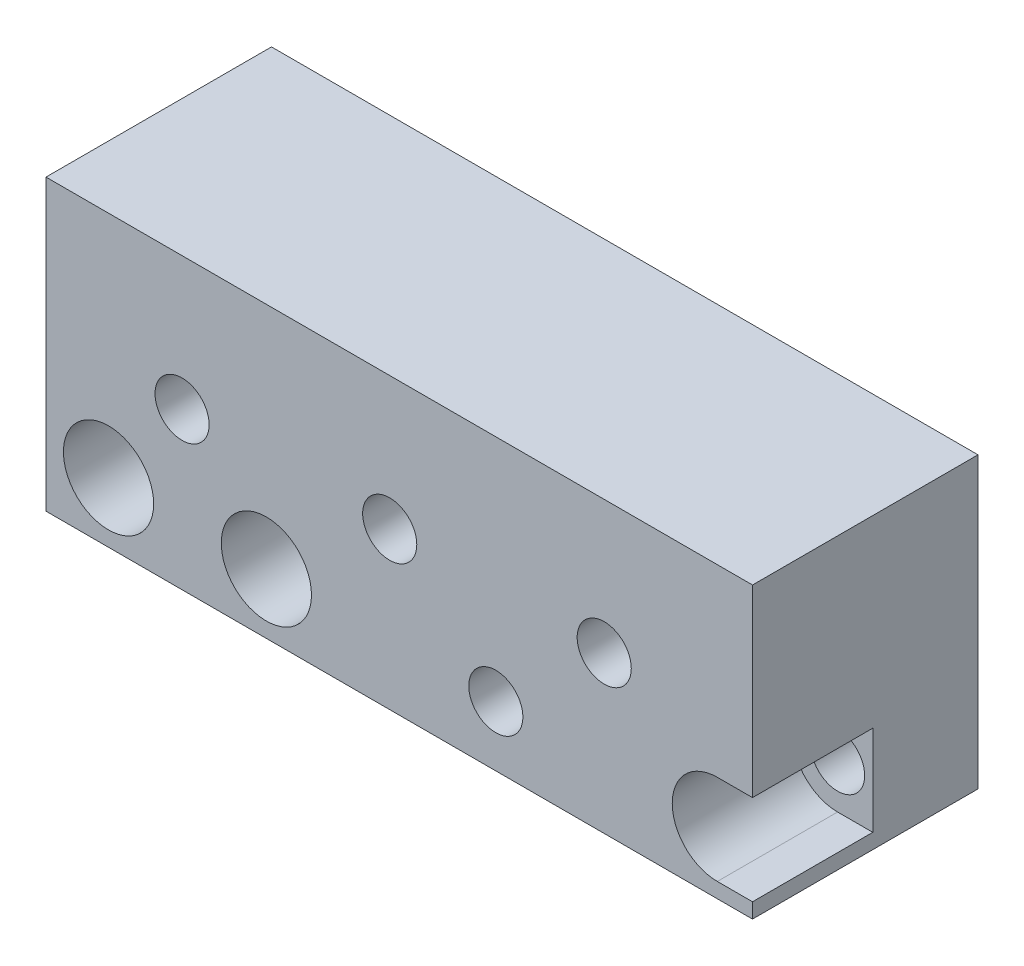
from build123d import *

# Parameters (mm, degrees)
SKETCH_1_W          = 47
SKETCH_1_H          = 20
EXTRUDE_1_DEPTH     = 15
SKETCH_2_R          = 1.8
CUT_EXTRUDE_1_DEPTH = 34.183673518
SKETCH_3_R          = 3
CUT_EXTRUDE_2_DEPTH = 8
SKETCH_4_R          = 1.8
CUT_EXTRUDE_3_DEPTH = 28
CUT_EXTRUDE_4_DEPTH = 8
SKETCH_6_W          = 47
SKETCH_6_H          = 0.75
CUT_EXTRUDE_5_DEPTH = 34.183673518
SKETCH_8_W          = 7.045850492
SKETCH_8_H          = 8.215580819
EXTRUDE_2_DEPTH     = 15
SKETCH_7_R          = 1.8
CUT_EXTRUDE_6_DEPTH = 34.183673518
SKETCH_9_R          = 3
CUT_EXTRUDE_7_DEPTH = 8
SKETCH_10_W         = 2.34075738
SKETCH_10_H         = 6
CUT_EXTRUDE_8_DEPTH = 8


with BuildPart() as part:
    # 草图1 → 凸台-拉伸1 (new body)
    with BuildSketch(Plane.XY):
        with Locations((2.432038835, 4.27184466)):
            Rectangle(SKETCH_1_W, SKETCH_1_H)
    extrude(amount=EXTRUDE_1_DEPTH)

    # 草图2 → 切除-拉伸1 (cut, through all)
    with BuildSketch(Plane.XY.offset(15)):
        with Locations((-16.908718548, -0.97815534)):
            Circle(SKETCH_2_R)
        with Locations((-6.408718548, -0.97815534)):
            Circle(SKETCH_2_R)
        with Locations((22.591281452, -0.97815534)):
            Circle(SKETCH_2_R)
    extrude(amount=-CUT_EXTRUDE_1_DEPTH, mode=Mode.SUBTRACT)

    # 草图3 → 切除-拉伸2 (cut)
    with BuildSketch(Plane.XY.offset(15)):
        with Locations((-16.908718548, -0.97815534)):
            Circle(SKETCH_3_R)
        with Locations((-6.408718548, -0.97815534)):
            Circle(SKETCH_3_R)
        with Locations((22.591281452, -0.97815534)):
            Circle(SKETCH_3_R)
    extrude(amount=-CUT_EXTRUDE_2_DEPTH, mode=Mode.SUBTRACT)

    # 草图4 → 切除-拉伸3 (cut)
    with BuildSketch(Plane.XY.offset(15)):
        with Locations((8.856176416, -0.97815534)):
            Circle(SKETCH_4_R)
        with Locations((-12.015922761, 5.426389834)):
            Circle(SKETCH_4_R)
        with Locations((1.797242631, 5.426389834)):
            Circle(SKETCH_4_R)
        with Locations((16.06746129, 5.426389834)):
            Circle(SKETCH_4_R)
    extrude(amount=-CUT_EXTRUDE_3_DEPTH, mode=Mode.SUBTRACT)

    # 草图5 → 切除-拉伸4 (cut)
    with BuildSketch(Plane(origin=(0, 0, 0), x_dir=(-1, 0, 0), z_dir=(0, 0, -1))):
        Polygon((-11.656176416, 0.638425414), (-11.656176416, -2.594736094), (-8.856176416, -4.211316847), (-6.056176416, -2.594736094), (-6.056176416, 0.638425414), (-8.856176416, 2.255006168), align=None)
        Polygon((-17.684042044, 2.626389834), (-14.450880536, 2.626389834), (-12.834299783, 5.426389834), (-14.450880536, 8.226389834), (-17.684042044, 8.226389834), (-19.300622797, 5.426389834), align=None)
        Polygon((-3.413823385, 2.626389834), (-0.180661878, 2.626389834), (1.435918876, 5.426389834), (-0.180661878, 8.226389834), (-3.413823385, 8.226389834), (-5.030404139, 5.426389834), align=None)
        Polygon((10.399342007, 2.626389834), (13.632503515, 2.626389834), (15.249084268, 5.426389834), (13.632503515, 8.226389834), (10.399342007, 8.226389834), (8.782761253, 5.426389834), align=None)
    extrude(amount=-CUT_EXTRUDE_4_DEPTH, mode=Mode.SUBTRACT)

    # 草图6 → 切除-拉伸5 (cut, through all)
    with BuildSketch(Plane.XY.offset(15)):
        with Locations((2.432038835, -5.35315534)):
            Rectangle(SKETCH_6_W, SKETCH_6_H)
    extrude(amount=-CUT_EXTRUDE_5_DEPTH, mode=Mode.SUBTRACT)

    # 草图8 → 凸台-拉伸2 (add, through all)
    with BuildSketch(Plane.XY.offset(15)):
        with Locations((22.409113589, -0.870364931)):
            Rectangle(SKETCH_8_W, SKETCH_8_H)
    extrude(amount=-EXTRUDE_2_DEPTH)

    # 草图7 → 切除-拉伸6 (cut, through all)
    with BuildSketch(Plane.XY.offset(15)):
        with Locations((23.591281455, -0.97815534)):
            Circle(SKETCH_7_R)
    extrude(amount=-CUT_EXTRUDE_6_DEPTH, mode=Mode.SUBTRACT)

    # 草图9 → 切除-拉伸7 (cut)
    with BuildSketch(Plane.XY.offset(15)):
        with Locations((23.591281455, -0.97815534)):
            Circle(SKETCH_9_R)
    extrude(amount=-CUT_EXTRUDE_7_DEPTH, mode=Mode.SUBTRACT)

    # 草图10 → 切除-拉伸8 (cut)
    with BuildSketch(Plane.XY.offset(15)):
        with Locations((24.761660145, -0.97815534)):
            Rectangle(SKETCH_10_W, SKETCH_10_H)
    extrude(amount=-CUT_EXTRUDE_8_DEPTH, mode=Mode.SUBTRACT)


solid = part.part
